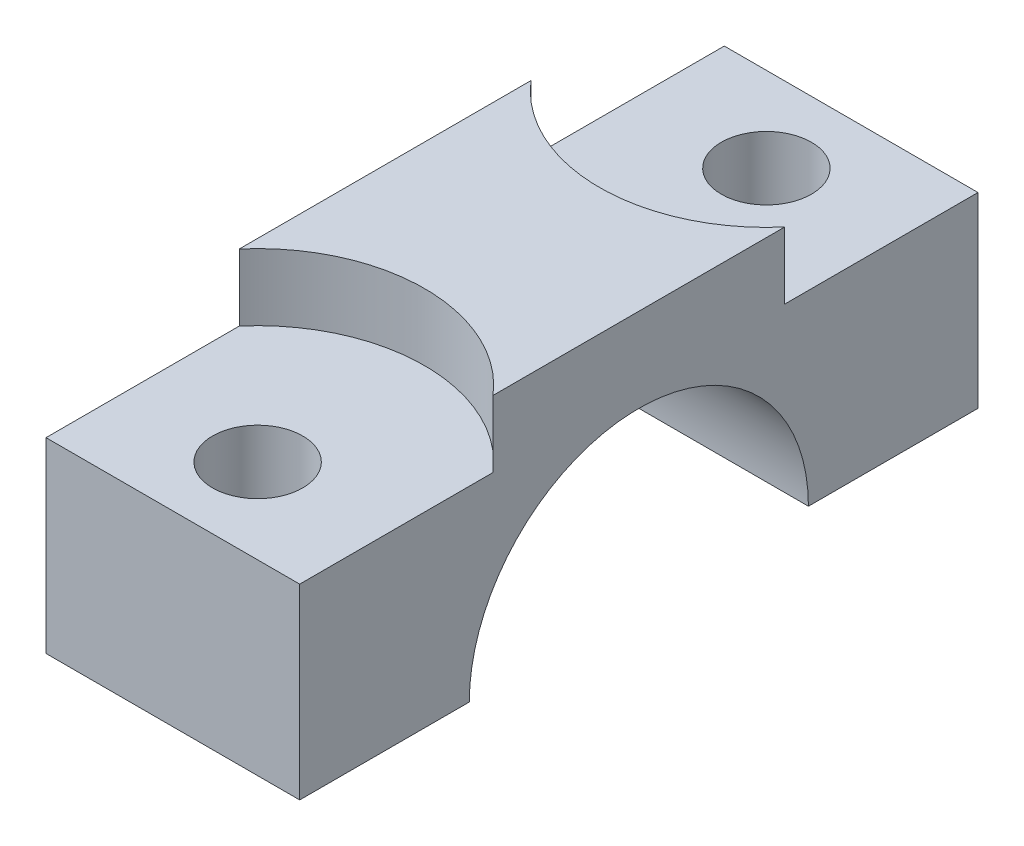
from build123d import *

# Parameters (mm, degrees)
BOSS_EXTRUDE1_DEPTH                           = 9.5
CBORE_FOR_M12_HEX_HEAD_CAP_SCREW2_D           = 6.75
CBORE_FOR_M12_HEX_HEAD_CAP_SCREW2_CBORE_D     = 25
CBORE_FOR_M12_HEX_HEAD_CAP_SCREW2_CBORE_DEPTH = 5


with BuildPart() as part:
    # Sketch1 → Boss-Extrude1 (new, symmetric)
    with BuildSketch(Plane(origin=(0, 0, 0), x_dir=(0, 0, -1), z_dir=(1, 0, 0))):
        with BuildLine():
            Line((12.7, 0), (25.4, 0))
            Line((25.4, 0), (25.4, 19))
            Line((25.4, 19), (-25.4, 19))
            Line((-25.4, 19), (-25.4, 0))
            Line((-25.4, 0), (-12.7, 0))
            ThreePointArc((-12.7, 0), (0, 12.7), (12.7, 0))
        make_face()
    extrude(amount=BOSS_EXTRUDE1_DEPTH, both=True)

    # CBORE for M12 Hex Head Cap Screw2 (through all)
    with Locations(Plane(origin=(0, 19, 0), x_dir=(1, 0, 0), z_dir=(0, 1, 0))):
        with Locations((0, 19.05), (0, -19.05)):
            CounterBoreHole(CBORE_FOR_M12_HEX_HEAD_CAP_SCREW2_D / 2, CBORE_FOR_M12_HEX_HEAD_CAP_SCREW2_CBORE_D / 2, CBORE_FOR_M12_HEX_HEAD_CAP_SCREW2_CBORE_DEPTH)


solid = part.part
